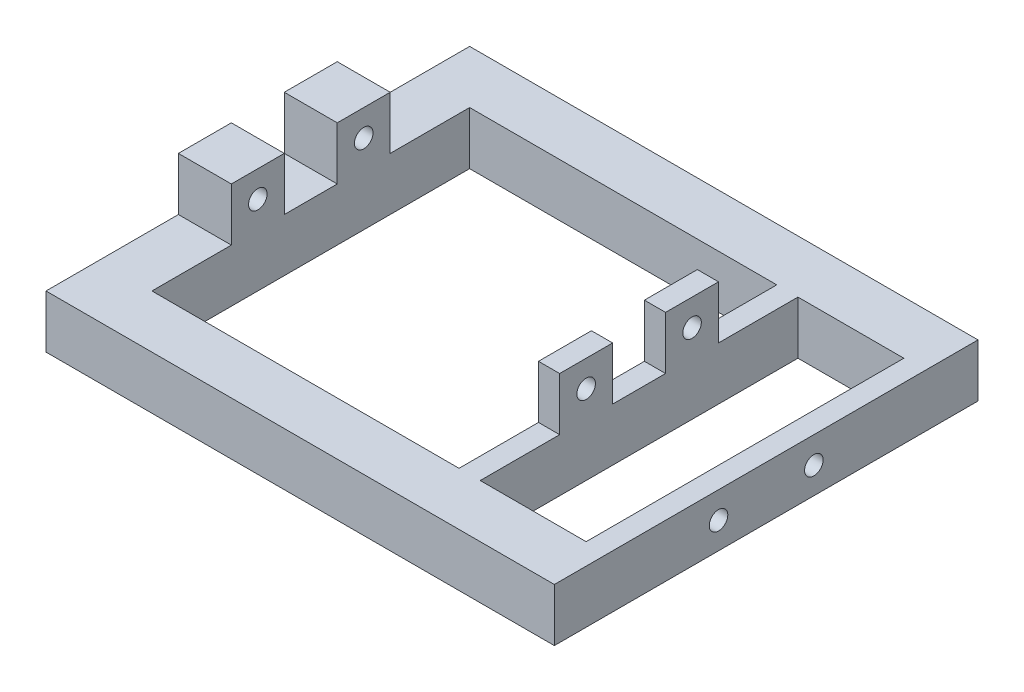
from build123d import *

# Parameters (mm, degrees)
SKETCH1_W           = 96
SKETCH1_H           = 80
SKETCH1_W_2         = 82
SKETCH1_H_2         = 60
BOSS_EXTRUDE1_DEPTH = 10
BOSS_EXTRUDE2_REACH = 121.231
SKETCH5_W           = 4
SKETCH5_H           = 10
SKETCH6_W           = 10
SKETCH6_H           = 10
SKETCH6_W_2         = 4
BOSS_EXTRUDE3_DEPTH = 10
SKETCH7_R           = 1.75
CUT_EXTRUDE3_DEPTH  = 110.471457467
CUT_EXTRUDE4_REACH  = 128.554
SKETCH10_R          = 1.75


with BuildPart() as part:
    # Sketch1 → Boss-Extrude1 (new body)
    with BuildSketch(Plane(origin=(0, 0, 0), x_dir=(1, 0, 0), z_dir=(0, 1, 0))):
        with Locations((48, 40)):
            Rectangle(SKETCH1_W, SKETCH1_H)
        with Locations((51, 40)):
            Rectangle(SKETCH1_W_2, SKETCH1_H_2, mode=Mode.SUBTRACT)
    extrude(amount=BOSS_EXTRUDE1_DEPTH)

    # Sketch5 → Boss-Extrude2 (add, up to next)
    with BuildSketch(Plane.XY.offset(-70), mode=Mode.PRIVATE) as boss_extrude2_sk1:
        with Locations((70, 5)):
            Rectangle(SKETCH5_W, SKETCH5_H)
    boss_extrude2_tool1 = extrude(boss_extrude2_sk1.sketch, amount=BOSS_EXTRUDE2_REACH, mode=Mode.PRIVATE) - part.part
    add(boss_extrude2_tool1.solids().sort_by_distance((70, 5, -70))[0])

    # Sketch6 → Boss-Extrude3 (add)
    with BuildSketch(Plane(origin=(0, 10, 0), x_dir=(1, 0, 0), z_dir=(0, 1, 0))):
        with Locations((5, 50)):
            Rectangle(SKETCH6_W, SKETCH6_H)
        with Locations((5, 30)):
            Rectangle(SKETCH6_W, SKETCH6_H)
        with Locations((70, 50)):
            Rectangle(SKETCH6_W_2, SKETCH6_H)
        with Locations((70, 30)):
            Rectangle(SKETCH6_W_2, SKETCH6_H)
    extrude(amount=BOSS_EXTRUDE3_DEPTH)

    # Sketch7 → Cut-Extrude3 (cut, through all)
    with BuildSketch(Plane(origin=(72, 0, 0), x_dir=(0, 0, -1), z_dir=(1, 0, 0))):
        with Locations((30, 15)):
            Circle(SKETCH7_R)
        with Locations((50, 15)):
            Circle(SKETCH7_R)
    extrude(amount=-CUT_EXTRUDE3_DEPTH, mode=Mode.SUBTRACT)

    # Sketch10 → Cut-Extrude4 (cut, up to next)
    with BuildSketch(Plane(origin=(96, 0, 0), x_dir=(0, 0, -1), z_dir=(1, 0, 0)), mode=Mode.PRIVATE) as cut_extrude4_sk1:
        with Locations((31, 5)):
            Circle(SKETCH10_R)
    cut_extrude4_tool1 = extrude(cut_extrude4_sk1.sketch, amount=-CUT_EXTRUDE4_REACH, mode=Mode.PRIVATE) & part.part
    # Sketch10 → Cut-Extrude4 (cut, up to next)
    with BuildSketch(Plane(origin=(96, 0, 0), x_dir=(0, 0, -1), z_dir=(1, 0, 0)), mode=Mode.PRIVATE) as cut_extrude4_sk2:
        with Locations((49, 5)):
            Circle(SKETCH10_R)
    cut_extrude4_tool2 = extrude(cut_extrude4_sk2.sketch, amount=-CUT_EXTRUDE4_REACH, mode=Mode.PRIVATE) & part.part
    add(cut_extrude4_tool1.solids().sort_by_distance((96, 5, -31))[0], mode=Mode.SUBTRACT)
    add(cut_extrude4_tool2.solids().sort_by_distance((96, 5, -49))[0], mode=Mode.SUBTRACT)


solid = part.part
